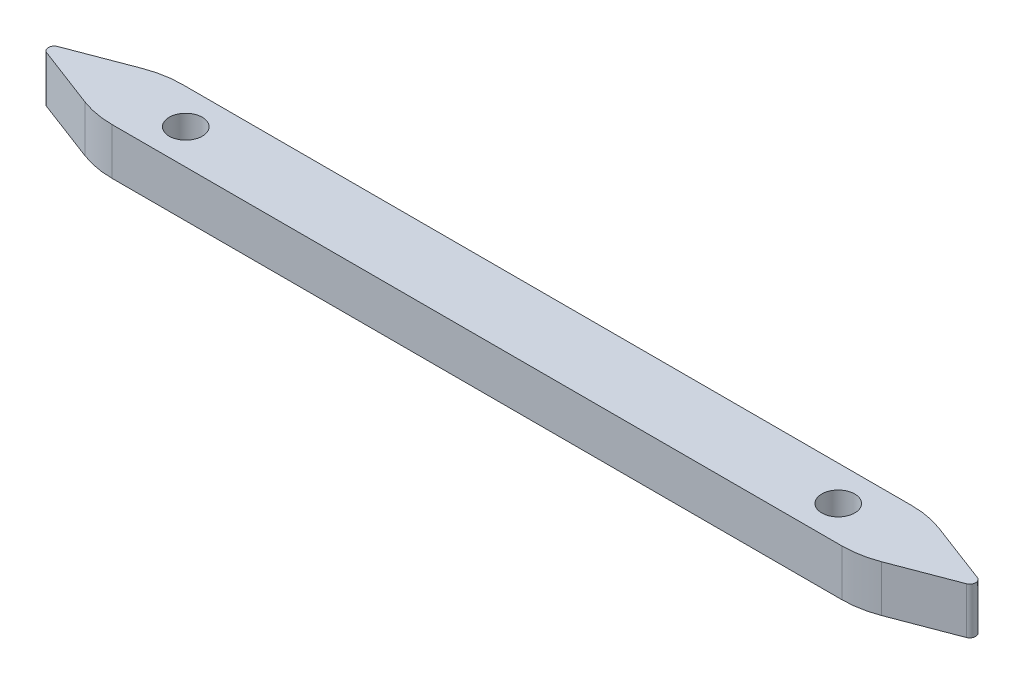
from build123d import *

# Parameters (mm, degrees)
BOSS_EXTRUDE2_DEPTH                               = 22.225
BOSS_EXTRUDE2_DEPTH_BACK                          = 10
SKETCH2_W                                         = 153.14353988
SKETCH2_H                                         = 6.35
CUT_EXTRUDE1_DEPTH                                = 4.7625
SKETCH3_W                                         = 152.758434582
SKETCH3_H                                         = 6.35
CUT_EXTRUDE2_DEPTH                                = 4.7625
FILLET3_R                                         = 12.7
FILLET4_R                                         = 12.7
FILLET5_R                                         = 12.7
FILLET6_R                                         = 12.7
CUT_EXTRUDE3_DEPTH                                = 94.675
CUT_EXTRUDE3_DEPTH_BACK                           = 84.675
SKETCH12_R                                        = 168.402
CSK_FOR_8_FLAT_HEAD_SOCKET_CAP_SCREW2_D           = 4.4958
CSK_FOR_8_FLAT_HEAD_SOCKET_CAP_SCREW2_CSINK_D     = 9.1186
CSK_FOR_8_FLAT_HEAD_SOCKET_CAP_SCREW2_CSINK_ANGLE = 82
SKETCH25_W                                        = 151.836061676
SKETCH25_H                                        = 46.299624525
CUT_EXTRUDE4_DEPTH                                = 10.16
SKETCH26_W                                        = 138.514547674
SKETCH26_H                                        = 27.845278494
CUT_EXTRUDE5_DEPTH                                = 23.368


with BuildPart() as part:
    # Sketch1 → Boss-Extrude2 (new, two sides: drawn at the far end of the back side and taken through both)
    with BuildSketch(Plane(origin=(0, 0, 0), x_dir=(1, 0, 0), z_dir=(0, 1, 0)).offset(-BOSS_EXTRUDE2_DEPTH_BACK)):
        with BuildLine():
            Line((37.204956004, 9.525), (-37.204956004, 9.525))
            ThreePointArc((-37.204956004, 9.525), (-39.498289417, 9.316221792), (-41.716221563, 8.696751473))
            Line((-41.716221563, 8.696751473), (-62.649818949, 0.741984467))
            ThreePointArc((-62.649818949, 0.741984467), (-63.161614851, 0), (-62.649818949, -0.741984467))
            Line((-62.649818949, -0.741984467), (-41.716221563, -8.696751473))
            ThreePointArc((-41.716221563, -8.696751473), (-39.498289417, -9.316221792), (-37.204956004, -9.525))
            Line((-37.204956004, -9.525), (37.204956004, -9.525))
            ThreePointArc((37.204956004, -9.525), (39.498289417, -9.316221792), (41.716221563, -8.696751473))
            Line((41.716221563, -8.696751473), (62.649818949, -0.741984467))
            ThreePointArc((62.649818949, -0.741984467), (63.161614851, 0), (62.649818949, 0.741984467))
            Line((62.649818949, 0.741984467), (41.716221563, 8.696751473))
            ThreePointArc((41.716221563, 8.696751473), (39.498289417, 9.316221792), (37.204956004, 9.525))
        make_face()
    extrude(amount=BOSS_EXTRUDE2_DEPTH + BOSS_EXTRUDE2_DEPTH_BACK)

    # Sketch2 → Cut-Extrude1 (cut)
    with BuildSketch(Plane.XY.offset(9.525)):
        with Locations((7.894658594, 12.7)):
            Rectangle(SKETCH2_W, SKETCH2_H)
    extrude(amount=-CUT_EXTRUDE1_DEPTH, mode=Mode.SUBTRACT)

    # Sketch3 → Cut-Extrude2 (cut)
    with BuildSketch(Plane(origin=(0, 0, -9.525), x_dir=(-1, 0, 0), z_dir=(0, 0, -1))):
        with Locations((8.600684972, 12.7)):
            Rectangle(SKETCH3_W, SKETCH3_H)
    extrude(amount=-CUT_EXTRUDE2_DEPTH, mode=Mode.SUBTRACT)

    # Fillet3
    fillet3_edges = [part.edges().sort_by_distance(p)[0] for p in [
        (52.069514915, 12.7, -4.7625),
    ]]
    fillet(fillet3_edges, radius=FILLET3_R)

    # Fillet4
    fillet4_edges = [part.edges().sort_by_distance(p)[0] for p in [
        (52.069514915, 12.7, 4.7625),
    ]]
    fillet(fillet4_edges, radius=FILLET4_R)

    # Fillet5
    fillet5_edges = [part.edges().sort_by_distance(p)[0] for p in [
        (-52.069514915, 12.7, 4.7625),
    ]]
    fillet(fillet5_edges, radius=FILLET5_R)

    # Fillet6
    fillet6_edges = [part.edges().sort_by_distance(p)[0] for p in [
        (-52.069514915, 12.7, -4.7625),
    ]]
    fillet(fillet6_edges, radius=FILLET6_R)

    # Sketch12 → Cut-Extrude3 (cut, two sides: drawn at the far end of the back side and taken through both)
    with BuildSketch(Plane(origin=(0, 0, 0), x_dir=(0, 0, -1), z_dir=(1, 0, 0)).offset(-CUT_EXTRUDE3_DEPTH_BACK)):
        with Locations((0, -168.402)):
            Circle(SKETCH12_R)
    extrude(amount=CUT_EXTRUDE3_DEPTH + CUT_EXTRUDE3_DEPTH_BACK, mode=Mode.SUBTRACT)

    # CSK for #8 Flat Head Socket Cap Screw2 (through all)
    with Locations(Plane(origin=(0, 22.225, 0), x_dir=(1, 0, 0), z_dir=(0, 1, 0))):
        with Locations((-44.45, 0), (44.45, 0)):
            CounterSinkHole(CSK_FOR_8_FLAT_HEAD_SOCKET_CAP_SCREW2_D / 2, CSK_FOR_8_FLAT_HEAD_SOCKET_CAP_SCREW2_CSINK_D / 2, counter_sink_angle=CSK_FOR_8_FLAT_HEAD_SOCKET_CAP_SCREW2_CSINK_ANGLE)

    # Sketch25 → Cut-Extrude4 (cut)
    with BuildSketch(Plane(origin=(0, 15.875, 0), x_dir=(1, 0, 0), z_dir=(0, 1, 0))):
        with Locations((2.779627567, -6.342868994)):
            Rectangle(SKETCH25_W, SKETCH25_H)
    extrude(amount=CUT_EXTRUDE4_DEPTH, mode=Mode.SUBTRACT)

    # Sketch26 → Cut-Extrude5 (cut)
    with BuildSketch(Plane(origin=(0, 9.525, 0), x_dir=(1, 0, 0), z_dir=(0, 1, 0))):
        with Locations((0.08280518, -0.921909218)):
            Rectangle(SKETCH26_W, SKETCH26_H)
    extrude(amount=-CUT_EXTRUDE5_DEPTH, mode=Mode.SUBTRACT)


solid = part.part
